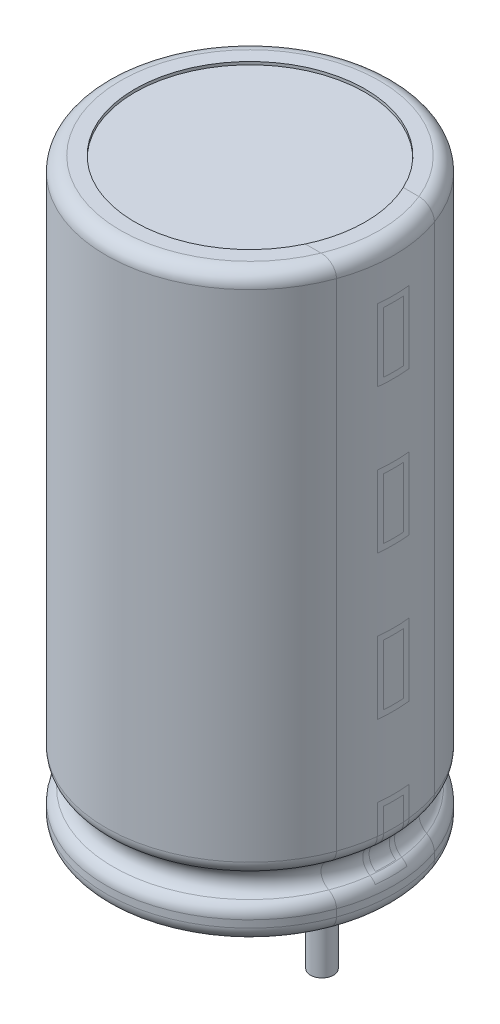
from build123d import *

# Parameters (mm, degrees)
BOSS_EXTRUDE1_DEPTH        = 1
BOSS_EXTRUDE1_DEPTH_BACK   = 3
SKETCH1_R                  = 0.4
BOSS_EXTRUDE1_2_DEPTH      = 1
BOSS_EXTRUDE1_2_DEPTH_BACK = 3


with BuildPart() as part:
    # Sketch1 → Boss-Extrude1 (new, two sides: drawn at the far end of the back side and taken through both)
    with BuildSketch(Plane(origin=(0, 0, 0), x_dir=(1, 0, 0), z_dir=(0, 1, 0)).offset(-BOSS_EXTRUDE1_DEPTH_BACK)):
        with Locations(Location((-2.5, 0, 0), (0, 0, 270))):
            Circle(SKETCH1_R)
    extrude(amount=BOSS_EXTRUDE1_DEPTH + BOSS_EXTRUDE1_DEPTH_BACK)



with BuildPart() as body_2:
    # Sketch1 → Boss-Extrude1 2 (new, two sides: drawn at the far end of the back side and taken through both)
    with BuildSketch(Plane(origin=(0, 0, 0), x_dir=(1, 0, 0), z_dir=(0, 1, 0)).offset(-BOSS_EXTRUDE1_2_DEPTH_BACK)):
        with Locations(Location((2.5, 0, 0), (0, 0, 90))):
            Circle(SKETCH1_R)
    extrude(amount=BOSS_EXTRUDE1_2_DEPTH + BOSS_EXTRUDE1_2_DEPTH_BACK)


with BuildPart() as part_1:
    add(part.part)

    add(body_2.part)  # Revolve1 merges body 2
    # Sketch3 → Revolve1 (revolve)
    with BuildSketch(Plane.XY):
        with BuildLine():
            Line((5, 0.5), (5, 0.75))
            ThreePointArc((5, 0.75), (4.933012702, 1), (4.75, 1.183012702))
            ThreePointArc((4.75, 1.183012702), (4.5, 1.616025404), (4.75, 2.049038106))
            ThreePointArc((4.75, 2.049038106), (4.933012702, 2.232050808), (5, 2.482050808))
            Line((5, 2.482050808), (5, 19.7))
            ThreePointArc((5, 19.7), (4.853553391, 20.053553391), (4.5, 20.2))
            Line((4.5, 20.2), (4, 20.2))
            Line((4, 20.2), (4, 20.1))
            Line((4, 20.1), (0, 20.1))
            Line((0, 20.1), (0, 0.1))
            Line((0, 0.1), (4, 0.1))
            Line((4, 0.1), (4, 0))
            Line((4, 0), (4.5, 0))
            ThreePointArc((4.5, 0), (4.853553391, 0.146446609), (5, 0.5))
        make_face()
    revolve(axis=Axis((0, 0.1, 0), (0, 1, 0)))


solid = part_1.part
